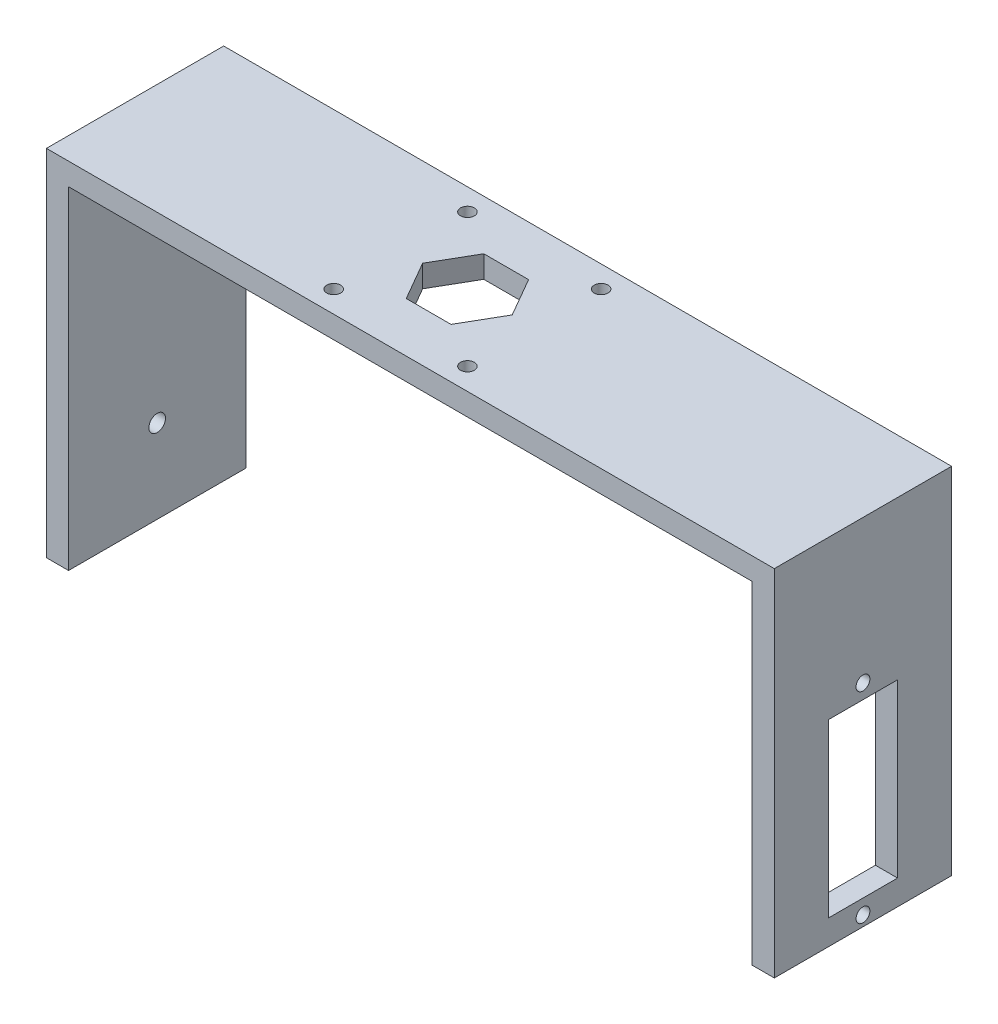
from build123d import *

# Parameters (mm, degrees)
BOSS_EXTRUDE1_DEPTH = 16
CUT_EXTRUDE2_REACH  = 149.03
SKETCH5_R           = 1.25
SKETCH5_W           = 12.5
SKETCH5_H           = 31
SKETCH5_3_R         = 1.5
CUT_EXTRUDE3_DEPTH  = 148.030473032
CUT_EXTRUDE1_REACH  = 99.211
SKETCH3_R           = 1.25


with BuildPart() as part:
    # Sketch1 → Boss-Extrude1 (new, symmetric)
    with BuildSketch(Plane.XY):
        Polygon((-56, 0), (-56, 60), (67.4, 60), (67.4, 0), (71.4, 0), (71.4, 64), (-60, 64), (-60, 0), align=None)
    extrude(amount=BOSS_EXTRUDE1_DEPTH, both=True)

    # Sketch5 → Cut-Extrude2 (cut, up to next)
    with BuildSketch(Plane(origin=(71.4, 0, 0), x_dir=(0, 0, -1), z_dir=(1, 0, 0)), mode=Mode.PRIVATE) as cut_extrude2_sk1:
        with Locations((0, 1.875)):
            Circle(SKETCH5_R)
    cut_extrude2_tool1 = extrude(cut_extrude2_sk1.sketch, amount=-CUT_EXTRUDE2_REACH, mode=Mode.PRIVATE) & part.part
    # Sketch5 → Cut-Extrude2 (cut, up to next)
    with BuildSketch(Plane(origin=(71.4, 0, 0), x_dir=(0, 0, -1), z_dir=(1, 0, 0)), mode=Mode.PRIVATE) as cut_extrude2_sk2:
        with Locations((0, 38.125)):
            Circle(SKETCH5_R)
    cut_extrude2_tool2 = extrude(cut_extrude2_sk2.sketch, amount=-CUT_EXTRUDE2_REACH, mode=Mode.PRIVATE) & part.part
    # Sketch5 → Cut-Extrude2 (cut, up to next)
    with BuildSketch(Plane(origin=(71.4, 0, 0), x_dir=(0, 0, -1), z_dir=(1, 0, 0)), mode=Mode.PRIVATE) as cut_extrude2_sk3:
        with Locations((0, 20)):
            Rectangle(SKETCH5_W, SKETCH5_H)
    cut_extrude2_tool3 = extrude(cut_extrude2_sk3.sketch, amount=-CUT_EXTRUDE2_REACH, mode=Mode.PRIVATE) & part.part
    add(cut_extrude2_tool1.solids().sort_by_distance((71.4, 1.875, 0))[0], mode=Mode.SUBTRACT)
    add(cut_extrude2_tool2.solids().sort_by_distance((71.4, 38.125, 0))[0], mode=Mode.SUBTRACT)
    add(cut_extrude2_tool3.solids().sort_by_distance((71.4, 20, 0))[0], mode=Mode.SUBTRACT)

    # Sketch5<3> → Cut-Extrude3 (cut, through all)
    with BuildSketch(Plane(origin=(71.4, 0, 0), x_dir=(0, 0, -1), z_dir=(1, 0, 0))):
        with Locations((0, 15.075)):
            Circle(SKETCH5_3_R)
    extrude(amount=-CUT_EXTRUDE3_DEPTH, mode=Mode.SUBTRACT)

    # Sketch3 → Cut-Extrude1 (cut, up to next)
    with BuildSketch(Plane(origin=(0, 64, 0), x_dir=(1, 0, 0), z_dir=(0, 1, 0)), mode=Mode.PRIVATE) as cut_extrude1_sk1:
        with Locations((-12.070312755, 12.070312755)):
            Circle(SKETCH3_R)
    cut_extrude1_tool1 = extrude(cut_extrude1_sk1.sketch, amount=-CUT_EXTRUDE1_REACH, mode=Mode.PRIVATE) & part.part
    # Sketch3 → Cut-Extrude1 (cut, up to next)
    with BuildSketch(Plane(origin=(0, 64, 0), x_dir=(1, 0, 0), z_dir=(0, 1, 0)), mode=Mode.PRIVATE) as cut_extrude1_sk2:
        with Locations((12.070312755, 12.070312755)):
            Circle(SKETCH3_R)
    cut_extrude1_tool2 = extrude(cut_extrude1_sk2.sketch, amount=-CUT_EXTRUDE1_REACH, mode=Mode.PRIVATE) & part.part
    # Sketch3 → Cut-Extrude1 (cut, up to next)
    with BuildSketch(Plane(origin=(0, 64, 0), x_dir=(1, 0, 0), z_dir=(0, 1, 0)), mode=Mode.PRIVATE) as cut_extrude1_sk3:
        with Locations((12.070312755, -12.070312755)):
            Circle(SKETCH3_R)
    cut_extrude1_tool3 = extrude(cut_extrude1_sk3.sketch, amount=-CUT_EXTRUDE1_REACH, mode=Mode.PRIVATE) & part.part
    # Sketch3 → Cut-Extrude1 (cut, up to next)
    with BuildSketch(Plane(origin=(0, 64, 0), x_dir=(1, 0, 0), z_dir=(0, 1, 0)), mode=Mode.PRIVATE) as cut_extrude1_sk4:
        with Locations((-12.070312755, -12.070312755)):
            Circle(SKETCH3_R)
    cut_extrude1_tool4 = extrude(cut_extrude1_sk4.sketch, amount=-CUT_EXTRUDE1_REACH, mode=Mode.PRIVATE) & part.part
    # Sketch3 → Cut-Extrude1 (cut, up to next)
    with BuildSketch(Plane(origin=(0, 64, 0), x_dir=(1, 0, 0), z_dir=(0, 1, 0)), mode=Mode.PRIVATE) as cut_extrude1_sk5:
        Polygon((4.041451884, -7), (8.082903769, 0), (4.041451884, 7), (-4.041451884, 7), (-8.082903769, 0), (-4.041451884, -7), align=None)
    cut_extrude1_tool5 = extrude(cut_extrude1_sk5.sketch, amount=-CUT_EXTRUDE1_REACH, mode=Mode.PRIVATE) & part.part
    add(cut_extrude1_tool1.solids().sort_by_distance((-12.070313, 64, -12.070313))[0], mode=Mode.SUBTRACT)
    add(cut_extrude1_tool2.solids().sort_by_distance((12.070313, 64, -12.070313))[0], mode=Mode.SUBTRACT)
    add(cut_extrude1_tool3.solids().sort_by_distance((12.070313, 64, 12.070313))[0], mode=Mode.SUBTRACT)
    add(cut_extrude1_tool4.solids().sort_by_distance((-12.070313, 64, 12.070313))[0], mode=Mode.SUBTRACT)
    add(cut_extrude1_tool5.solids().sort_by_distance((0, 64, 0))[0], mode=Mode.SUBTRACT)


solid = part.part
